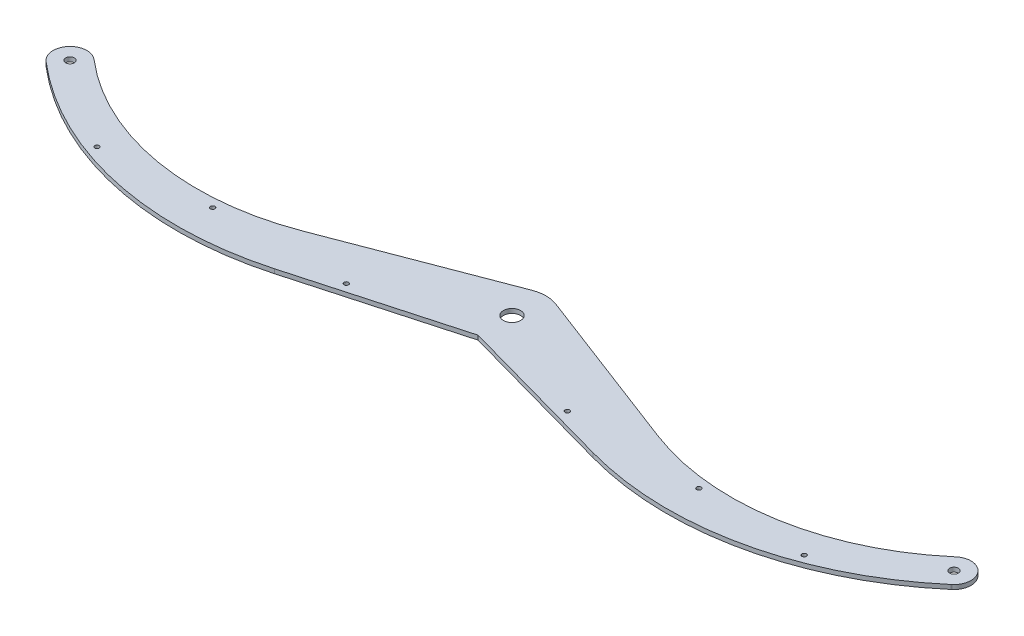
from build123d import *

# Parameters (mm, degrees)
BOSS_EXTRUDE1_DEPTH = 3.18
SKETCH3_R           = 3.175
SKETCH3_R_2         = 6.35
SKETCH3_R_3         = 1.65
CUT_EXTRUDE1_DEPTH  = 344.936785066


with BuildPart() as part:
    # Sketch1 → Boss-Extrude1 (new body)
    with BuildSketch(Plane(origin=(0, 0, 0), x_dir=(1, 0, 0), z_dir=(0, 1, 0))):
        with BuildLine():
            Line((-316.883271773, 9.506246519), (-316.457354569, 9.142585196))
            ThreePointArc((-316.457354569, 9.142585196), (-227.815789201, -32.465901654), (-130.352994696, -23.000333716))
            Line((-130.352994696, -23.000333716), (-8.915781366, 23.356130729))
            ThreePointArc((-8.915781366, 23.356130729), (0, 25), (8.915781366, 23.356130729))
            Line((8.915781366, 23.356130729), (130.352994696, -23.000333716))
            ThreePointArc((130.352994696, -23.000333716), (227.815789201, -32.465901654), (316.457354569, 9.142585196))
            Line((316.457354569, 9.142585196), (316.883271773, 9.506246519))
            ThreePointArc((316.883271773, 9.506246519), (334.506246519, 8.116728227), (333.116728227, -9.506246519))
            Line((333.116728227, -9.506246519), (332.690811024, -9.869907842))
            ThreePointArc((332.690811024, -9.869907842), (230.873321689, -60.601151934), (117.157638275, -57.567407196))
            Line((117.157638275, -57.567407196), (0, -25))
            Line((0, -25), (-117.157638275, -57.567407196))
            ThreePointArc((-117.157638275, -57.567407196), (-230.873321689, -60.601151934), (-332.690811024, -9.869907842))
            Line((-332.690811024, -9.869907842), (-333.116728227, -9.506246519))
            ThreePointArc((-333.116728227, -9.506246519), (-334.506246519, 8.116728227), (-316.883271773, 9.506246519))
        make_face()
    extrude(amount=BOSS_EXTRUDE1_DEPTH)

    # Sketch3 → Cut-Extrude1 (cut, through all)
    with BuildSketch(Plane(origin=(0, 3.18, 0), x_dir=(1, 0, 0), z_dir=(0, 1, 0))):
        with Locations(Location((-325, 0, 0), (0, 0, 270))):
            Circle(SKETCH3_R)
        with Locations(Location((0, 0, 0), (0, 0, 270))):
            Circle(SKETCH3_R_2)
        with Locations(Location((-260, -45.151120288, 0), (0, 0, 270))):
            Circle(SKETCH3_R_3)
        with Locations(Location((-178.75, -41.327805807, 0), (0, 0, 270))):
            Circle(SKETCH3_R_3)
        with Locations(Location((-81.25, -40.58582431, 0), (0, 0, 270))):
            Circle(SKETCH3_R_3)
        with Locations(Location((81.25, -40.58582431, 0), (0, 0, 270))):
            Circle(SKETCH3_R_3)
        with Locations(Location((178.75, -41.327805807, 0), (0, 0, 270))):
            Circle(SKETCH3_R_3)
        with Locations(Location((260, -45.151120288, 0), (0, 0, 270))):
            Circle(SKETCH3_R_3)
        with Locations(Location((325, 0, 0), (0, 0, 270))):
            Circle(SKETCH3_R)
    extrude(amount=-CUT_EXTRUDE1_DEPTH, mode=Mode.SUBTRACT)


solid = part.part
